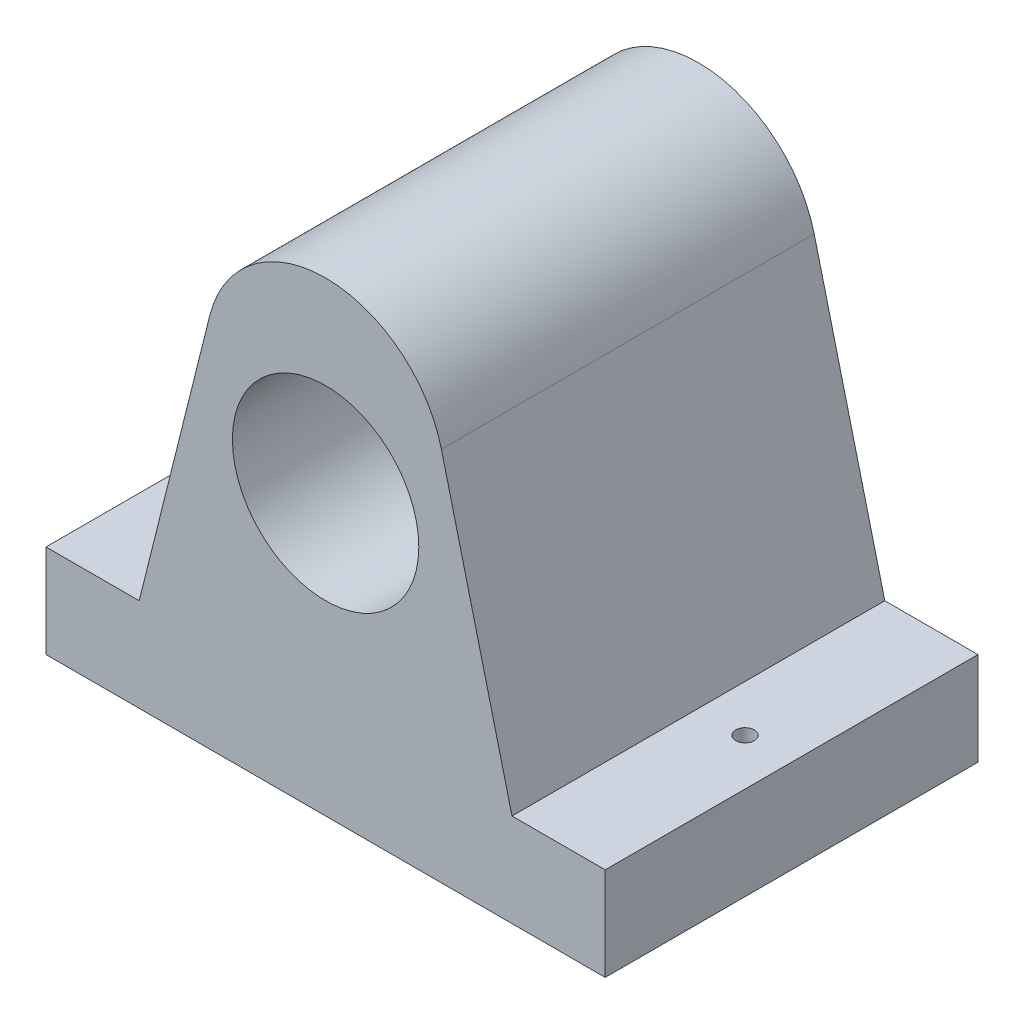
from build123d import *

# Parameters (mm, degrees)
SKETCH1_W           = 300
SKETCH1_H           = 250
BOSS_EXTRUDE1_DEPTH = 200
SKETCH2_W           = 50
SKETCH2_H           = 200
CUT_EXTRUDE1_DEPTH  = 200
SKETCH3_W           = 50
SKETCH3_H           = 200
CUT_EXTRUDE2_DEPTH  = 200
CUT_EXTRUDE3_DEPTH  = 200
CUT_EXTRUDE4_DEPTH  = 200
FILLET1_R           = 64.03882
SKETCH6_R           = 50
CUT_EXTRUDE5_DEPTH  = 200
SKETCH8_R           = 5
CUT_EXTRUDE6_DEPTH  = 200
SKETCH9_R           = 5
CUT_EXTRUDE7_DEPTH  = 200


with BuildPart() as part:
    # Sketch1 → Boss-Extrude1 (new body)
    with BuildSketch(Plane.XY):
        with Locations((150, 125)):
            Rectangle(SKETCH1_W, SKETCH1_H)
    extrude(amount=BOSS_EXTRUDE1_DEPTH)

    # Sketch2 → Cut-Extrude1 (cut)
    with BuildSketch(Plane.XY.offset(200)):
        with Locations((25, 150)):
            Rectangle(SKETCH2_W, SKETCH2_H)
    extrude(amount=-CUT_EXTRUDE1_DEPTH, mode=Mode.SUBTRACT)

    # Sketch3 → Cut-Extrude2 (cut)
    with BuildSketch(Plane.XY.offset(200)):
        with Locations((275, 150)):
            Rectangle(SKETCH3_W, SKETCH3_H)
    extrude(amount=-CUT_EXTRUDE2_DEPTH, mode=Mode.SUBTRACT)

    # Sketch4 → Cut-Extrude3 (cut)
    with BuildSketch(Plane(origin=(0, 0, 0), x_dir=(-1, 0, 0), z_dir=(0, 0, -1))):
        Polygon((-50, 250), (-100, 250), (-50, 50), align=None)
    extrude(amount=-CUT_EXTRUDE3_DEPTH, mode=Mode.SUBTRACT)

    # Sketch5 → Cut-Extrude4 (cut)
    with BuildSketch(Plane(origin=(0, 0, 0), x_dir=(-1, 0, 0), z_dir=(0, 0, -1))):
        Polygon((-250, 250), (-200, 250), (-250, 50), align=None)
    extrude(amount=-CUT_EXTRUDE4_DEPTH, mode=Mode.SUBTRACT)

    # Fillet1
    fillet1_edges = [part.edges().sort_by_distance(p)[0] for p in [
        (100, 250, 100),
        (200, 250, 100),
    ]]
    fillet(fillet1_edges, radius=FILLET1_R)

    # Sketch6 → Cut-Extrude5 (cut)
    with BuildSketch(Plane(origin=(0, 0, 0), x_dir=(-1, 0, 0), z_dir=(0, 0, -1))):
        with Locations((-150, 150)):
            Circle(SKETCH6_R)
    extrude(amount=-CUT_EXTRUDE5_DEPTH, mode=Mode.SUBTRACT)

    # Sketch8 → Cut-Extrude6 (cut)
    with BuildSketch(Plane(origin=(0, 50, 0), x_dir=(1, 0, 0), z_dir=(0, 1, 0))):
        with Locations(Location((25, -100, 0), (0, 0, 270))):
            Circle(SKETCH8_R)
    extrude(amount=-CUT_EXTRUDE6_DEPTH, mode=Mode.SUBTRACT)

    # Sketch9 → Cut-Extrude7 (cut)
    with BuildSketch(Plane(origin=(0, 50, 0), x_dir=(1, 0, 0), z_dir=(0, 1, 0))):
        with Locations(Location((275, -100, 0), (0, 0, 270))):
            Circle(SKETCH9_R)
    extrude(amount=-CUT_EXTRUDE7_DEPTH, mode=Mode.SUBTRACT)


solid = part.part
